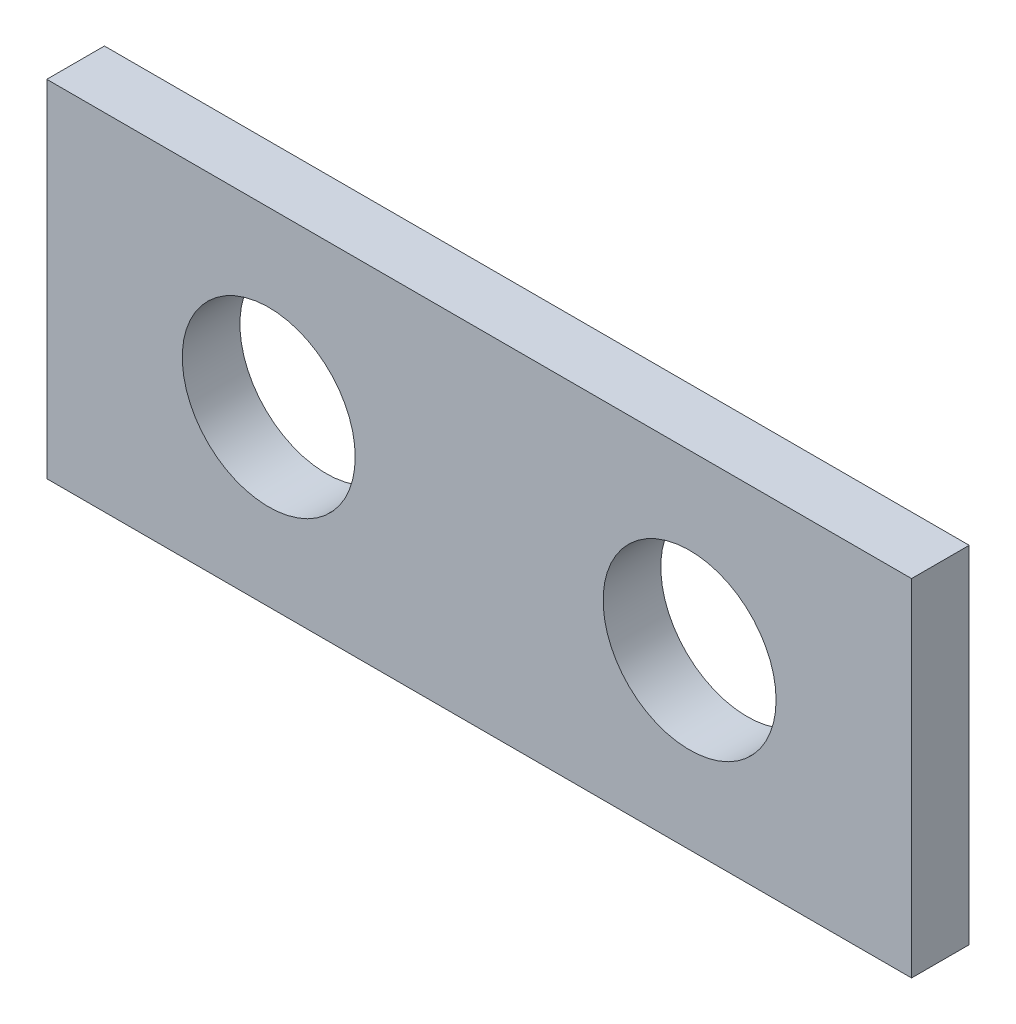
from build123d import *

# Parameters (mm, degrees)
SKETCH1_W           = 15
SKETCH1_H           = 6
SKETCH1_R           = 1.5
BOSS_EXTRUDE1_DEPTH = 1


with BuildPart() as part:
    # Sketch1 → Boss-Extrude1 (new body)
    with BuildSketch(Plane.XY):
        with Locations((-7.5, 3)):
            Rectangle(SKETCH1_W, SKETCH1_H)
        with Locations((-3.85, 3)):
            Circle(SKETCH1_R, mode=Mode.SUBTRACT)
        with Locations((-11.15, 3)):
            Circle(SKETCH1_R, mode=Mode.SUBTRACT)
    extrude(amount=BOSS_EXTRUDE1_DEPTH)


solid = part.part
